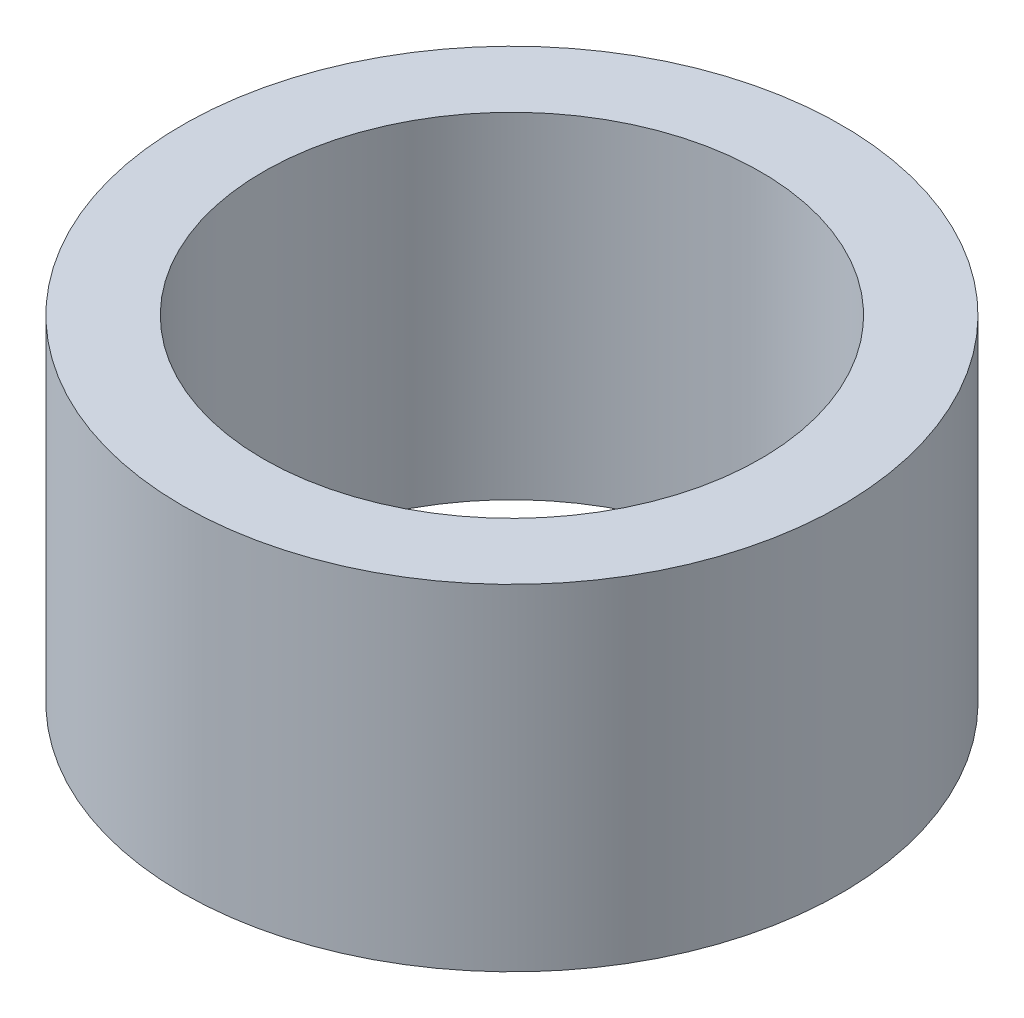
from build123d import *

# Parameters (mm, degrees)
SKETCH1_R           = 5.5
SKETCH1_R_2         = 4.15
BOSS_EXTRUDE1_DEPTH = 5.6


with BuildPart() as part:
    # Sketch1 → Boss-Extrude1 (new body)
    with BuildSketch(Plane(origin=(0, 0, 0), x_dir=(1, 0, 0), z_dir=(0, 1, 0))):
        with Locations(Location((0, 0, 0), (0, 0, 270))):
            Circle(SKETCH1_R)
        with Locations(Location((0, 0, 0), (0, 0, 270))):
            Circle(SKETCH1_R_2, mode=Mode.SUBTRACT)
    extrude(amount=BOSS_EXTRUDE1_DEPTH)


solid = part.part
